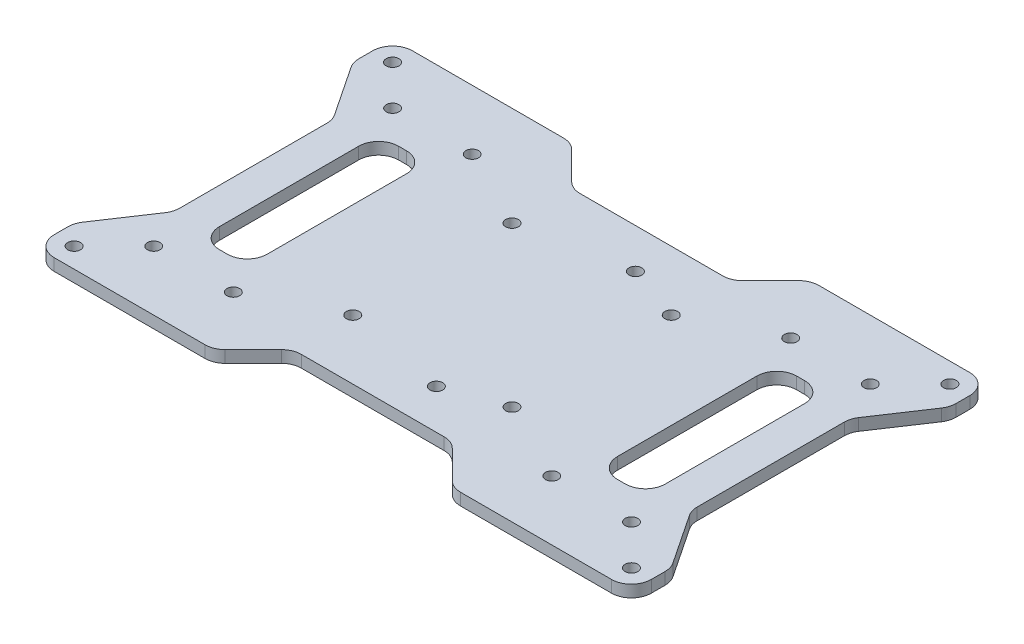
from build123d import *

# Parameters (mm, degrees)
CROQUIS1_W              = 150
CROQUIS1_H              = 90
CROQUIS1_R              = 1.5875
SALIENTE_EXTRUIR1_DEPTH = 3
CROQUIS2_R              = 1.5875
CORTAR_EXTRUIR1_DEPTH   = 3
CROQUIS3_R              = 1.6
ANCLAJE_BANDA_DEPTH     = 10
CROQUIS4_R              = 1.6
ESPACIO_CENTRO_DEPTH    = 10
CROQUIS5_R              = 1.6
ESPACIO_EXTERNO_DEPTH   = 10
CROQUIS6_W              = 12
CROQUIS6_H              = 45
QUITA_PESO_DEPTH        = 10
REDONDEO1_R             = 5


with BuildPart() as part:
    # Croquis1 → Saliente-Extruir1 (new body)
    with BuildSketch(Plane(origin=(0, 0, 0), x_dir=(1, 0, 0), z_dir=(0, 1, 0))):
        Rectangle(CROQUIS1_W, CROQUIS1_H)
        with Locations(Location((-60, 30, 0), (0, 0, 270))):
            Circle(CROQUIS1_R, mode=Mode.SUBTRACT)
        with Locations(Location((-60, -30, 0), (0, 0, 270))):
            Circle(CROQUIS1_R, mode=Mode.SUBTRACT)
        with Locations(Location((60, -30, 0), (0, 0, 270))):
            Circle(CROQUIS1_R, mode=Mode.SUBTRACT)
        with Locations(Location((60, 30, 0), (0, 0, 270))):
            Circle(CROQUIS1_R, mode=Mode.SUBTRACT)
    extrude(amount=SALIENTE_EXTRUIR1_DEPTH)

    # Croquis2 → Cortar-Extruir1 (cut)
    with BuildSketch(Plane(origin=(0, 3, 0), x_dir=(1, 0, 0), z_dir=(0, 1, 0))):
        with Locations(Location((-40, 30, 0), (0, 0, 270))):
            Circle(CROQUIS2_R)
        with Locations(Location((-40, -30, 0), (0, 0, 270))):
            Circle(CROQUIS2_R)
        with Locations(Location((40, -30, 0), (0, 0, 270))):
            Circle(CROQUIS2_R)
        with Locations(Location((40, 30, 0), (0, 0, 270))):
            Circle(CROQUIS2_R)
    extrude(amount=-CORTAR_EXTRUIR1_DEPTH, mode=Mode.SUBTRACT)

    # Croquis3 → Anclaje_Banda (cut)
    with BuildSketch(Plane(origin=(0, 3, 0), x_dir=(1, 0, 0), z_dir=(0, 1, 0))):
        with Locations(Location((6, -25, 0), (0, 0, 270))):
            Circle(CROQUIS3_R)
        with Locations(Location((6, 25, 0), (0, 0, 270))):
            Circle(CROQUIS3_R)
    extrude(amount=-ANCLAJE_BANDA_DEPTH, mode=Mode.SUBTRACT)

    # Croquis4 → Espacio_Centro (cut)
    with BuildSketch(Plane(origin=(0, 3, 0), x_dir=(1, 0, 0), z_dir=(0, 1, 0))):
        with Locations(Location((20, -20, 0), (0, 0, 270))):
            Circle(CROQUIS4_R)
        with Locations(Location((-20, -20, 0), (0, 0, 270))):
            Circle(CROQUIS4_R)
        with Locations(Location((-20, 20, 0), (0, 0, 270))):
            Circle(CROQUIS4_R)
        with Locations(Location((20, 20, 0), (0, 0, 270))):
            Circle(CROQUIS4_R)
    extrude(amount=-ESPACIO_CENTRO_DEPTH, mode=Mode.SUBTRACT)

    # Croquis5 → Espacio_externo (cut)
    with BuildSketch(Plane(origin=(0, 3, 0), x_dir=(1, 0, 0), z_dir=(0, 1, 0))):
        with Locations(Location((-70, 40, 0), (0, 0, 270))):
            Circle(CROQUIS5_R)
        with Locations(Location((70, 40, 0), (0, 0, 270))):
            Circle(CROQUIS5_R)
        with Locations(Location((70, -40, 0), (0, 0, 270))):
            Circle(CROQUIS5_R)
        with Locations(Location((-70, -40, 0), (0, 0, 270))):
            Circle(CROQUIS5_R)
    extrude(amount=-ESPACIO_EXTERNO_DEPTH, mode=Mode.SUBTRACT)

    # Croquis6 → Quita_peso (cut)
    with BuildSketch(Plane(origin=(0, 3, 0), x_dir=(1, 0, 0), z_dir=(0, 1, 0))):
        Polygon((-75, 35), (-65, 20), (-65, -20), (-75, -35), align=None)
        Polygon((75, 35), (75, -35), (65, -20), (65, 20), align=None)
        with Locations((-50, 0)):
            Rectangle(CROQUIS6_W, CROQUIS6_H)
        with Locations((50, 0)):
            Rectangle(CROQUIS6_W, CROQUIS6_H)
        Polygon((-30, 45), (-20, 35), (20, 35), (30, 45), align=None)
        Polygon((20, -35), (30, -45), (-30, -45), (-20, -35), align=None)
    extrude(amount=-QUITA_PESO_DEPTH, mode=Mode.SUBTRACT)

    # Redondeo1
    redondeo1_edges = [part.edges().sort_by_distance(p)[0] for p in [
        (-75, 1.5, 35),
        (-75, 1.5, -35),
        (-65, 1.5, -20),
        (-65, 1.5, 20),
        (-30, 1.5, 45),
        (30, 1.5, 45),
        (-30, 1.5, -45),
        (30, 1.5, -45),
        (75, 1.5, 35),
        (75, 1.5, -35),
        (-20, 1.5, 35),
        (20, 1.5, 35),
        (20, 1.5, -35),
        (-20, 1.5, -35),
        (56, 1.5, -22.5),
        (56, 1.5, 22.5),
        (44, 1.5, 22.5),
        (44, 1.5, -22.5),
        (-44, 1.5, -22.5),
        (-44, 1.5, 22.5),
        (-56, 1.5, 22.5),
        (-56, 1.5, -22.5),
        (65, 1.5, 20),
        (65, 1.5, -20),
        (75, 1.5, 45),
        (-75, 1.5, 45),
        (-75, 1.5, -45),
        (75, 1.5, -45),
    ]]
    fillet(redondeo1_edges, radius=REDONDEO1_R)


solid = part.part
